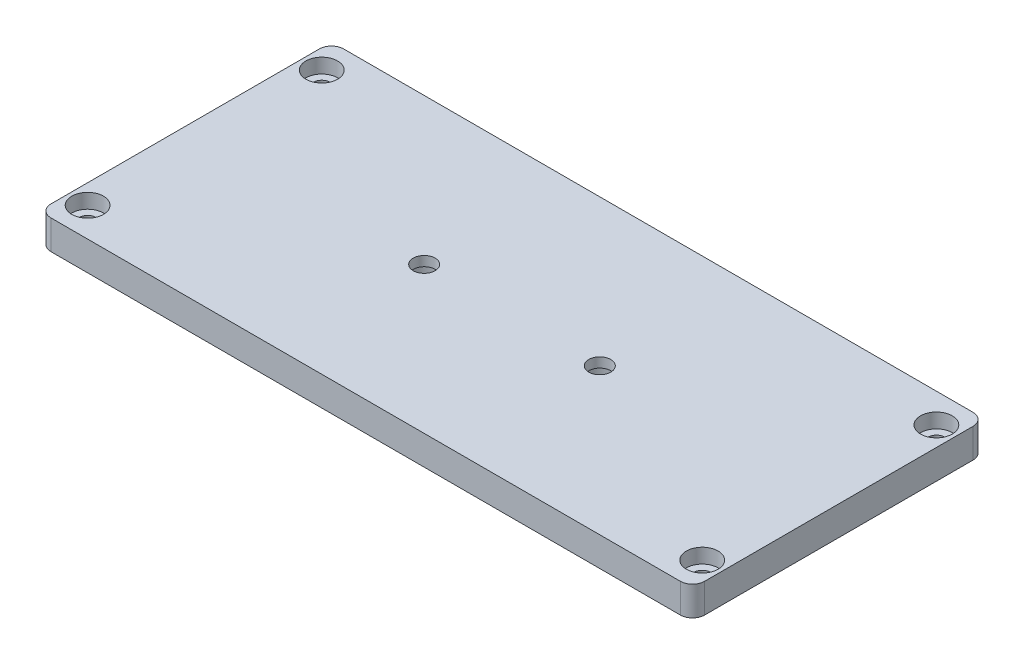
from build123d import *

# Parameters (mm, degrees)
SKETCH1_W                      = 134
SKETCH1_H                      = 60
BOSS_EXTRUDE1_DEPTH            = 6
CBORE_FOR_M3_SHCS1_D           = 3.4
CBORE_FOR_M3_SHCS1_DEPTH       = 17.38
CBORE_FOR_M3_SHCS1_CBORE_D     = 6.5
CBORE_FOR_M3_SHCS1_CBORE_DEPTH = 3
CBORE_FOR_M3_SHCS1_TIP         = 1.021463052
FILLET1_R                      = 2.5
CBORE_FOR_M4_SHCS1_D           = 4.5
CBORE_FOR_M4_SHCS1_DEPTH       = 12
CBORE_FOR_M4_SHCS1_CBORE_D     = 8
CBORE_FOR_M4_SHCS1_CBORE_DEPTH = 4
CBORE_FOR_M4_SHCS1_TIP         = 1.351936393


with BuildPart() as part:
    # Sketch1 → Boss-Extrude1 (new body)
    with BuildSketch(Plane(origin=(0, 0, 0), x_dir=(1, 0, 0), z_dir=(0, 1, 0))):
        Rectangle(SKETCH1_W, SKETCH1_H)
    extrude(amount=BOSS_EXTRUDE1_DEPTH)

    # CBORE for M3 SHCS1
    with Locations(Plane(origin=(0, 6, 0), x_dir=(1, 0, 0), z_dir=(0, 1, 0))):
        with Locations((-63, 24), (-63, -24), (63, -24), (63, 24)):
            CounterBoreHole(CBORE_FOR_M3_SHCS1_D / 2, CBORE_FOR_M3_SHCS1_CBORE_D / 2, CBORE_FOR_M3_SHCS1_CBORE_DEPTH, depth=CBORE_FOR_M3_SHCS1_DEPTH)
            with Locations((0, 0, -(CBORE_FOR_M3_SHCS1_DEPTH + CBORE_FOR_M3_SHCS1_TIP / 2))):  # 118° drill point
                Cone(0, CBORE_FOR_M3_SHCS1_D / 2, CBORE_FOR_M3_SHCS1_TIP, mode=Mode.SUBTRACT)

    # Fillet1
    fillet1_edges = [part.edges().sort_by_distance(p)[0] for p in [
        (67, 3, 30),
        (-67, 3, 30),
        (-67, 3, -30),
        (67, 3, -30),
    ]]
    fillet(fillet1_edges, radius=FILLET1_R)

    # CBORE for M4 SHCS1
    with Locations(Plane.XZ):
        with Locations((-18, 0), (18, 0)):
            CounterBoreHole(CBORE_FOR_M4_SHCS1_D / 2, CBORE_FOR_M4_SHCS1_CBORE_D / 2, CBORE_FOR_M4_SHCS1_CBORE_DEPTH, depth=CBORE_FOR_M4_SHCS1_DEPTH)
            with Locations((0, 0, -(CBORE_FOR_M4_SHCS1_DEPTH + CBORE_FOR_M4_SHCS1_TIP / 2))):  # 118° drill point
                Cone(0, CBORE_FOR_M4_SHCS1_D / 2, CBORE_FOR_M4_SHCS1_TIP, mode=Mode.SUBTRACT)


solid = part.part
